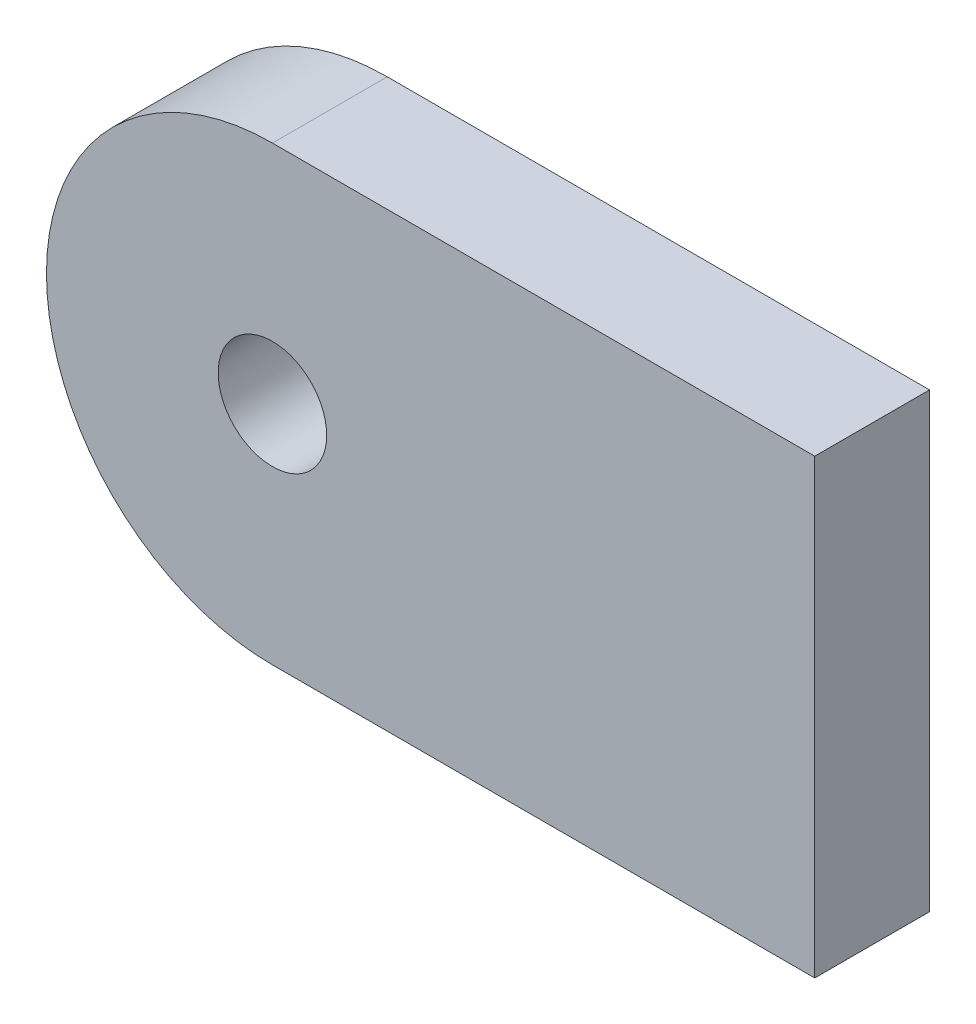
from build123d import *

# Parameters (mm, degrees)
SKETCH1_R           = 3
BOSS_EXTRUDE1_DEPTH = 6.35


with BuildPart() as part:
    # Sketch1 → Boss-Extrude1 (new body)
    with BuildSketch(Plane.XY.offset(36.015266699)):
        with BuildLine():
            Line((-1.608835655, 1.421229345), (-31.608835655, 1.421229345))
            ThreePointArc((-31.608835655, 1.421229345), (-44.108835655, 13.921229345), (-31.608835655, 26.421229345))
            Line((-31.608835655, 26.421229345), (-1.608835655, 26.421229345))
            Line((-1.608835655, 26.421229345), (-1.608835655, 1.421229345))
        make_face()
        with Locations((-31.608835655, 13.921229345)):
            Circle(SKETCH1_R, mode=Mode.SUBTRACT)
    extrude(amount=BOSS_EXTRUDE1_DEPTH)


solid = part.part
